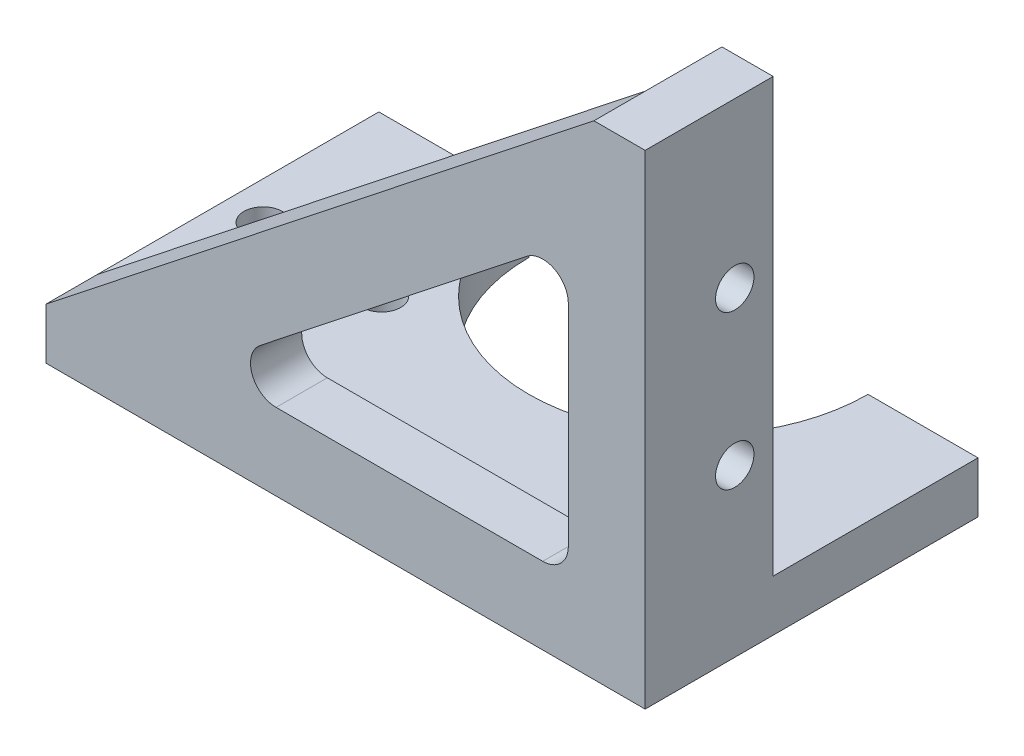
from build123d import *

# Parameters (mm, degrees)
EXTRUDE_1_DEPTH     = 26
EXTRUDE_2_DEPTH     = 4
SKETCH_3_R          = 1.5
SKETCH_3_R_2        = 13.25
CUT_EXTRUDE_1_DEPTH = 49.641546028
SKETCH_4_W          = 16
SKETCH_4_H          = 33.8
CUT_EXTRUDE_2_DEPTH = 10
SKETCH_5_R          = 1.5
CUT_EXTRUDE_3_DEPTH = 10
CUT_EXTRUDE_4_DEPTH = 10
FILLET_1_R          = 2


with BuildPart() as part:
    # 草图1 → 凸台-拉伸1 (new body)
    with BuildSketch(Plane.XY):
        Polygon((23.4, 2), (23.4, 16.071572875), (23.4, 21.728427125), (23.4, 35.8), (19.4, 35.8), (19.4, 2), (-16.4, 2), (-23.4, 2), (-23.4, -2), (23.4, -2), align=None)
    extrude(amount=EXTRUDE_1_DEPTH)

    # 草图2 → 凸台-拉伸2 (add)
    with BuildSketch(Plane.XY.offset(26)):
        Polygon((19.4, 35.8), (19.4, 2), (-23.4, 2), align=None)
    extrude(amount=-EXTRUDE_2_DEPTH)

    # 草图3 → 切除-拉伸1 (cut, through all)
    with BuildSketch(Plane(origin=(0, 2, 0), x_dir=(1, 0, 0), z_dir=(0, 1, 0))):
        with Locations(Location((13.934368671, -12.374368671, 0), (0, 0, 180))):
            Circle(SKETCH_3_R)
        with Locations(Location((-10.814368671, -12.374368671, 0), (0, 0, 180))):
            Circle(SKETCH_3_R)
        with Locations((-10.814368671, 12.374368671)):
            Circle(SKETCH_3_R)
        with Locations((13.934368671, 12.374368671)):
            Circle(SKETCH_3_R)
        with Locations((1.56, 0)):
            Circle(SKETCH_3_R_2)
        with Locations(Location((-20.44, -12, 0), (0, 0, 180))):
            Circle(SKETCH_3_R)
    extrude(amount=-CUT_EXTRUDE_1_DEPTH, mode=Mode.SUBTRACT)

    # 草图4 → 切除-拉伸2 (cut)
    with BuildSketch(Plane.ZY.offset(-19.4)):
        with Locations((8, 18.9)):
            Rectangle(SKETCH_4_W, SKETCH_4_H)
    extrude(amount=-CUT_EXTRUDE_2_DEPTH, mode=Mode.SUBTRACT)

    # 草图5 → 切除-拉伸3 (cut)
    with BuildSketch(Plane.ZY.offset(-19.4)):
        with Locations(Location((19, 23, 0), (0, 0, 270))):
            Circle(SKETCH_5_R)
        with Locations(Location((19, 11, 0), (0, 0, 270))):
            Circle(SKETCH_5_R)
    extrude(amount=-CUT_EXTRUDE_3_DEPTH, mode=Mode.SUBTRACT)

    # 草图6 → 切除-拉伸4 (cut)
    with BuildSketch(Plane.XY.offset(26)):
        Polygon((17.4, 26.575192531), (17.4, 4), (-11.186338471, 4), align=None)
    extrude(amount=-CUT_EXTRUDE_4_DEPTH, mode=Mode.SUBTRACT)

    # 圆角1
    fillet_1_edges = [part.edges().sort_by_distance(p)[0] for p in [
        (-11.186338471, 4, 24),
        (17.4, 26.575192531, 24),
        (17.4, 4, 24),
    ]]
    fillet(fillet_1_edges, radius=FILLET_1_R)


solid = part.part
